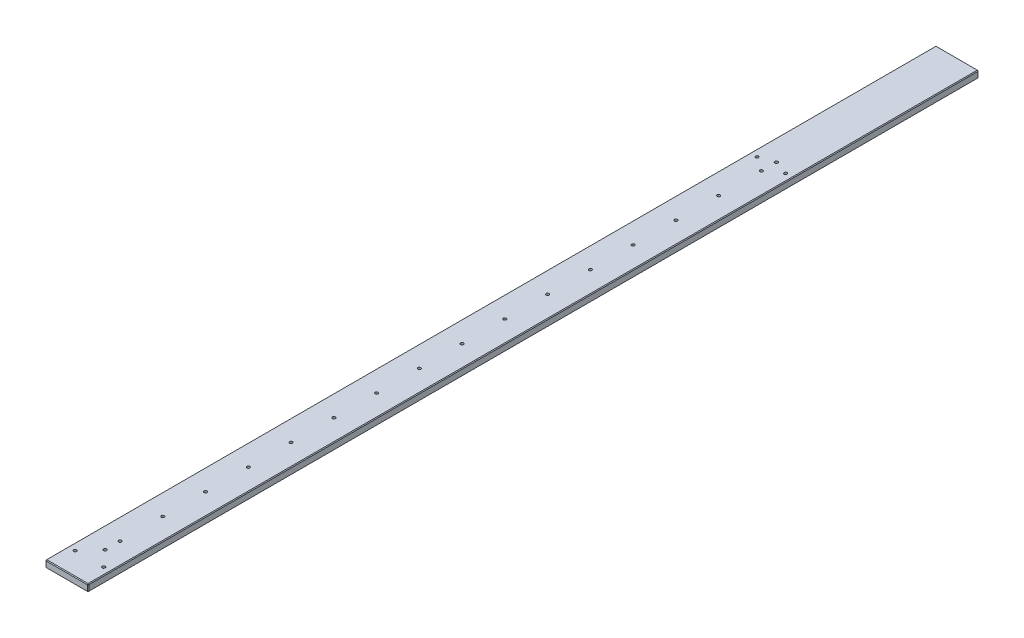
from build123d import *

# Parameters (mm, degrees)
SKETCH_1_W         = 60
SKETCH_1_H         = 10
EXTRUDE_2_DEPTH    = 1250
HOLE_WIZARD_M5_2_D = 4.2
HOLE_WIZARD_M5_1_D = 4.2
CHAMFER_1_SIZE     = 1
HOLE_WIZARD_M5_3_D = 4.2
HOLE_WIZARD_M5_4_D = 4.2


with BuildPart() as part:
    # 草图1 → 凸台-拉伸2 (new body)
    with BuildSketch(Plane.XY):
        Rectangle(SKETCH_1_W, SKETCH_1_H)
    extrude(amount=EXTRUDE_2_DEPTH)

    # M5 螺纹孔2 (through all)
    with Locations(Plane(origin=(0, -5, 0), x_dir=(-1, 0, 0), z_dir=(0, -1, 0))):
        with Locations((0, -275), (0, -335), (0, -395), (0, -455), (0, -515), (0, -575), (0, -635), (0, -695), (0, -755), (0, -815), (0, -875), (0, -935), (0, -995), (0, -1055), (0, -1115), (0, -1175)):
            Hole(HOLE_WIZARD_M5_2_D / 2)

    # M5 螺纹孔1 (through all)
    with Locations(Plane(origin=(0, -5, 0), x_dir=(-1, 0, 0), z_dir=(0, -1, 0))):
        with Locations((0, -254), (0, -1196)):
            Hole(HOLE_WIZARD_M5_1_D / 2)

    # 倒角1
    chamfer_1_edges = [part.edges().sort_by_distance(p)[0] for p in [
        (-30, 0, 1250),
        (0, -5, 1250),
        (30, 0, 1250),
        (0, -5, 0),
        (-30, 0, 0),
        (0, 5, 0),
        (30, 0, 0),
        (0, 5, 1250),
        (30, -5, 625),
        (-30, -5, 625),
        (-30, 5, 625),
        (30, 5, 625),
    ]]
    chamfer(chamfer_1_edges, length=CHAMFER_1_SIZE)

    # M5 螺纹孔3 (through all)
    with Locations(Plane(origin=(0, -5, 0), x_dir=(-1, 0, 0), z_dir=(0, -1, 0))):
        with Locations((-20, -261), (20, -261)):
            Hole(HOLE_WIZARD_M5_3_D / 2)

    # M5 螺纹孔4 (through all)
    with Locations(Plane(origin=(0, 5, 0), x_dir=(1, 0, 0), z_dir=(0, 1, 0))):
        with Locations((20, -1218), (-20, -1218)):
            Hole(HOLE_WIZARD_M5_4_D / 2)


solid = part.part
